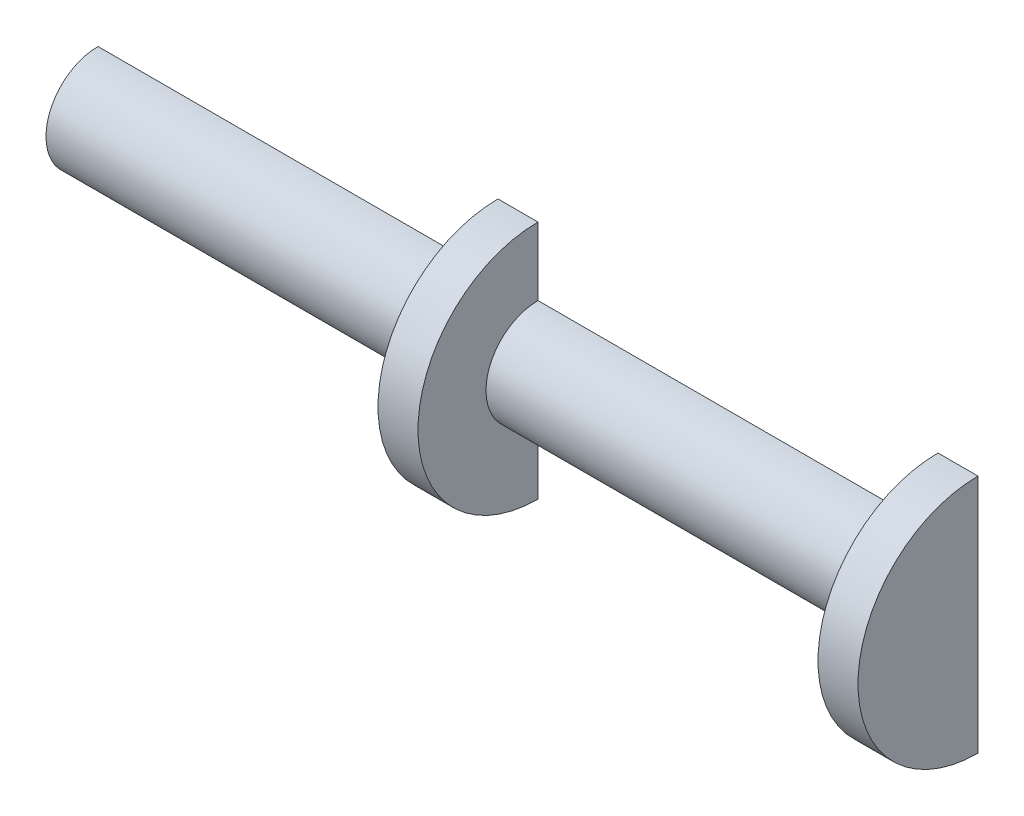
from build123d import *

# Parameters (mm, degrees)
SKETCH1_W               = 111.76
SKETCH1_H               = 3.302
SKETCH6_W               = 2.54
SKETCH6_H               = 4.318
CUT_EXTRUDE1_DEPTH      = 57.909605516
CUT_EXTRUDE1_DEPTH_BACK = 57.909605516
SKETCH7_W               = 7.62
SKETCH7_H               = 15.24
SKETCH8_W               = 55.88
SKETCH8_H               = 15.24
CUT_EXTRUDE2_DEPTH      = 57.909605516


with BuildPart() as part:
    # Sketch1 → Revolve1 (revolve)
    with BuildSketch(Plane.XY, mode=Mode.PRIVATE) as revolve1_sk:
        with Locations((0, 1.651)):
            Rectangle(SKETCH1_W, SKETCH1_H)
    revolve(revolve1_sk.sketch.rotate(Axis((-55.88, 0, 0), (1, 0, 0)), 90), axis=Axis((-55.88, 0, 0), (1, 0, 0)))

    # Sketch6 → Revolve2 (revolve)
    with BuildSketch(Plane.XY, mode=Mode.PRIVATE) as revolve2_sk:
        with Locations((-26.67, 5.461)):
            Rectangle(SKETCH6_W, SKETCH6_H)
        with Locations((26.67, 5.461)):
            Rectangle(SKETCH6_W, SKETCH6_H)
        with Locations((-54.61, 5.461)):
            Rectangle(SKETCH6_W, SKETCH6_H)
        with Locations((54.61, 5.461)):
            Rectangle(SKETCH6_W, SKETCH6_H)
    revolve(revolve2_sk.sketch.rotate(Axis((-31.878421892, 0, 0), (1, 0, 0)), 90), axis=Axis((-31.878421892, 0, 0), (1, 0, 0)))

    # Sketch7 → Cut-Extrude1 (cut, two sides: drawn at the far end of the back side and taken through both)
    with BuildSketch(Plane(origin=(0, 0, 0), x_dir=(0, 0, -1), z_dir=(1, 0, 0)).offset(-CUT_EXTRUDE1_DEPTH_BACK)):
        with Locations((3.81, 0)):
            Rectangle(SKETCH7_W, SKETCH7_H)
    extrude(amount=CUT_EXTRUDE1_DEPTH + CUT_EXTRUDE1_DEPTH_BACK, mode=Mode.SUBTRACT)

    # Sketch8 → Cut-Extrude2 (cut, through all)
    with BuildSketch(Plane.XY):
        with Locations((-27.94, 0)):
            Rectangle(SKETCH8_W, SKETCH8_H)
    extrude(amount=CUT_EXTRUDE2_DEPTH, mode=Mode.SUBTRACT)


solid = part.part
